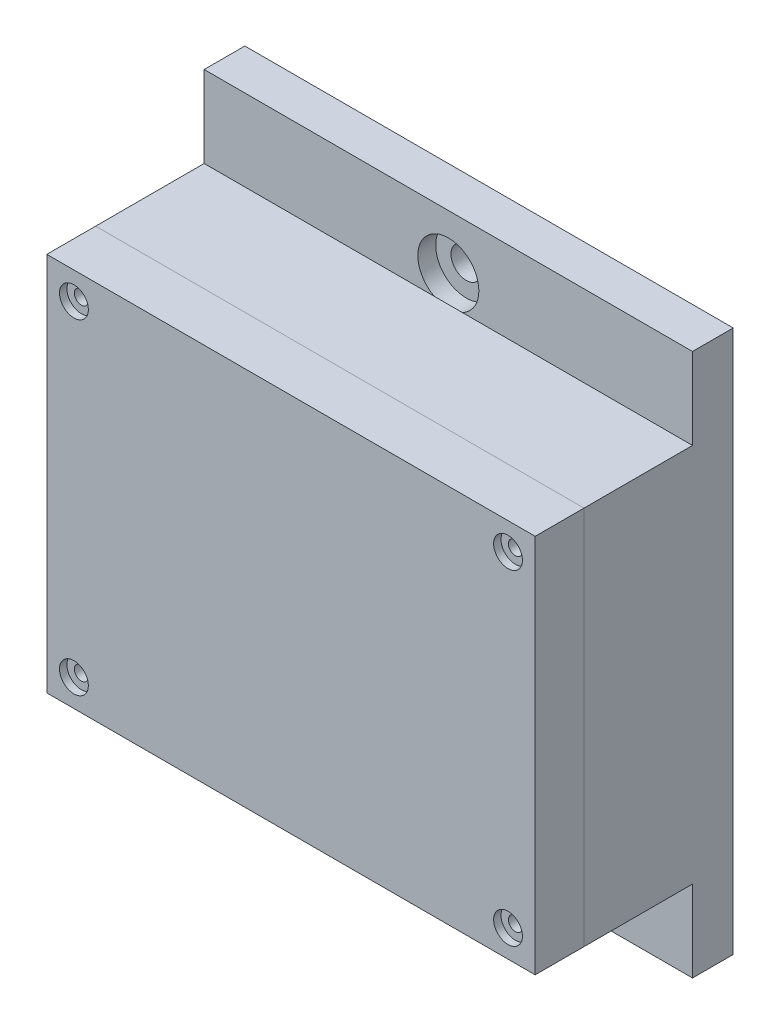
from build123d import *

# Parameters (mm, degrees)
SKETCH1_W                                            = 114.3
SKETCH1_H                                            = 127
BASE_DEPTH                                           = 9.525
CBORE_FOR_1_4_BINDING_HEAD_MACHINE_SCREW_D           = 7.14248
CBORE_FOR_1_4_BINDING_HEAD_MACHINE_SCREW_CBORE_D     = 14.2875
CBORE_FOR_1_4_BINDING_HEAD_MACHINE_SCREW_CBORE_DEPTH = 4.191
SKETCH4_W                                            = 114.3
SKETCH4_H                                            = 88.9
BOSS_EXTRUDE2_DEPTH                                  = 25.4
CUT_EXTRUDE1_REACH                                   = 129.04
SKETCH11_W                                           = 75.490330722
SKETCH11_H                                           = 17.78
CUT_EXTRUDE2_REACH                                   = 137.338
SKETCH12_W                                           = 17.78
SKETCH12_H                                           = 63.5
F_4_CLEARANCE_HOLE1_D                                = 3.2639
F_4_CLEARANCE_HOLE1_DEPTH                            = 6.35
F_4_CLEARANCE_HOLE1_TIP                              = 0.980574487
F_4_CLEARANCE_HOLE2_D                                = 3.2639
F_4_CLEARANCE_HOLE2_DEPTH                            = 6.35
F_4_CLEARANCE_HOLE2_TIP                              = 0.980574487
SKETCH23_W                                           = 6.35
SKETCH23_H                                           = 12.7
BOSS_EXTRUDE5_DEPTH                                  = 17.78
F_4_CLEARANCE_HOLE3_D                                = 3.2639
F_4_CLEARANCE_HOLE3_DEPTH                            = 6.35
F_4_CLEARANCE_HOLE3_TIP                              = 0.980574487
SKETCH27_W                                           = 29.42336
SKETCH27_H                                           = 43.18
BOSS_EXTRUDE6_DEPTH                                  = 5.08
BOSS_EXTRUDE3_DEPTH                                  = 5.08
BOSS_EXTRUDE3_2_DEPTH                                = 5.08
FILLET3_R                                            = 2.54
SKETCH14_W                                           = 114.3
SKETCH14_H                                           = 88.9
BOSS_EXTRUDE4_DEPTH                                  = 6.35
FILLET1_R                                            = 2.54
CBORE_FOR_4_BINDING_HEAD_MACHINE_SC_2_COUNT          = 2
CBORE_FOR_4_BINDING_HEAD_MACHINE_SC_2_PITCH          = 76.2
CBORE_FOR_4_BINDING_HEAD_MACHINE_SC_3_COUNT          = 2
CBORE_FOR_4_BINDING_HEAD_MACHINE_SC_3_PITCH          = 127
CBORE_FOR_4_BINDING_HEAD_MACHINE_SC_4_COUNT          = 2
CBORE_FOR_4_BINDING_HEAD_MACHINE_SC_4_PITCH          = 101.6


with BuildPart() as part:
    # Sketch1 → base (new body)
    with BuildSketch(Plane.XY):
        Rectangle(SKETCH1_W, SKETCH1_H)
    extrude(amount=BASE_DEPTH)

    # CBORE for 1/4 Binding Head Machine Screw1 (through all)
    with Locations(Plane.XY.offset(9.525)):
        with Locations((0, 50.8), (0, -50.8)):
            CounterBoreHole(CBORE_FOR_1_4_BINDING_HEAD_MACHINE_SCREW_D / 2, CBORE_FOR_1_4_BINDING_HEAD_MACHINE_SCREW_CBORE_D / 2, CBORE_FOR_1_4_BINDING_HEAD_MACHINE_SCREW_CBORE_DEPTH)

    # Sketch4 → Boss-Extrude2 (add)
    with BuildSketch(Plane.XY.offset(9.525)):
        Rectangle(SKETCH4_W, SKETCH4_H)
        Polygon((-43.460165361, 38.1), (43.460165361, 38.1), (43.460165361, 18.034), (43.460165361, 12.954), (43.460165361, -12.954), (43.460165361, -18.034), (43.460165361, -38.1), (-43.460165361, -38.1), align=None, mode=Mode.SUBTRACT)
    extrude(amount=BOSS_EXTRUDE2_DEPTH)

    # Sketch11 → Cut-Extrude1 (cut, up to next)
    with BuildSketch(Plane.XZ.offset(44.45), mode=Mode.PRIVATE) as cut_extrude1_sk1:
        with Locations((0.635, 26.035)):
            Rectangle(SKETCH11_W, SKETCH11_H)
    cut_extrude1_tool1 = extrude(cut_extrude1_sk1.sketch, amount=-CUT_EXTRUDE1_REACH, mode=Mode.PRIVATE) & part.part
    add(cut_extrude1_tool1.solids().sort_by_distance((0.635, -44.45, 26.035))[0], mode=Mode.SUBTRACT)

    # Sketch12 → Cut-Extrude2 (cut, up to next)
    with BuildSketch(Plane.ZY.offset(57.15), mode=Mode.PRIVATE) as cut_extrude2_sk1:
        with Locations((26.035, 0)):
            Rectangle(SKETCH12_W, SKETCH12_H)
    cut_extrude2_tool1 = extrude(cut_extrude2_sk1.sketch, amount=-CUT_EXTRUDE2_REACH, mode=Mode.PRIVATE) & part.part
    add(cut_extrude2_tool1.solids().sort_by_distance((-57.15, 0, 26.035))[0], mode=Mode.SUBTRACT)

    # #4 Clearance Hole1
    with Locations(Plane.XY.offset(34.925)):
        with Locations((50.8, 38.1), (50.8, -38.1), (-50.8, -38.1), (-50.8, 38.1)):
            Hole(F_4_CLEARANCE_HOLE1_D / 2, depth=F_4_CLEARANCE_HOLE1_DEPTH)
            with Locations((0, 0, -(F_4_CLEARANCE_HOLE1_DEPTH + F_4_CLEARANCE_HOLE1_TIP / 2))):  # 118° drill point
                Cone(0, F_4_CLEARANCE_HOLE1_D / 2, F_4_CLEARANCE_HOLE1_TIP, mode=Mode.SUBTRACT)

    # #4 Clearance Hole2
    with Locations(Plane.XY.offset(9.525)):
        with Locations((-35.814, -30.48), (-35.814, 30.48), (7.366, -30.48), (7.366, 30.48)):
            Hole(F_4_CLEARANCE_HOLE2_D / 2, depth=F_4_CLEARANCE_HOLE2_DEPTH)
            with Locations((0, 0, -(F_4_CLEARANCE_HOLE2_DEPTH + F_4_CLEARANCE_HOLE2_TIP / 2))):  # 118° drill point
                Cone(0, F_4_CLEARANCE_HOLE2_D / 2, F_4_CLEARANCE_HOLE2_TIP, mode=Mode.SUBTRACT)

    # Sketch23 → Boss-Extrude5 (add)
    with BuildSketch(Plane.XY.offset(9.525)):
        with Locations((17.211805361, 11.43)):
            Rectangle(SKETCH23_W, SKETCH23_H)
        with Locations((40.285165361, 11.43)):
            Rectangle(SKETCH23_W, SKETCH23_H)
    extrude(amount=BOSS_EXTRUDE5_DEPTH)

    # #4 Clearance Hole3
    with Locations(Plane(origin=(0, 5.08, 0), x_dir=(-1, 0, 0), z_dir=(0, -1, 0))):
        with Locations((-17.211805361, -20.955), (-40.285165361, -20.955)):
            Hole(F_4_CLEARANCE_HOLE3_D / 2, depth=F_4_CLEARANCE_HOLE3_DEPTH)
            with Locations((0, 0, -(F_4_CLEARANCE_HOLE3_DEPTH + F_4_CLEARANCE_HOLE3_TIP / 2))):  # 118° drill point
                Cone(0, F_4_CLEARANCE_HOLE3_D / 2, F_4_CLEARANCE_HOLE3_TIP, mode=Mode.SUBTRACT)

    # Sketch27 → Boss-Extrude6 (add)
    with BuildSketch(Plane.XY.offset(9.525)):
        with Locations((28.748485361, -16.51)):
            Rectangle(SKETCH27_W, SKETCH27_H)
    extrude(amount=BOSS_EXTRUDE6_DEPTH)

    # Fillet3
    fillet3_edges = [part.edges().sort_by_distance(p)[0] for p in [
        (43.460165361, 38.1, 22.225),
        (-43.460165361, 38.1, 22.225),
        (-43.460165361, -38.1, 22.225),
        (43.460165361, -38.1, 24.765),
        (-37.110165361, -44.45, 26.035),
        (38.380165361, -44.45, 26.035),
        (-57.15, -31.75, 26.035),
        (-57.15, 31.75, 26.035),
    ]]
    fillet(fillet3_edges, radius=FILLET3_R)


with BuildPart() as body_2:
    # Sketch13 → Boss-Extrude3 (new body)
    with BuildSketch(Plane.XY.offset(40.005)):
        Polygon((-43.460165361, 31.75), (-57.15, 31.75), (-57.15, 44.45), (57.15, 44.45), (57.15, -44.45), (38.380165361, -44.45), (38.380165361, -38.1), (43.460165361, -38.1), (43.460165361, 38.1), (-43.460165361, 38.1), align=None)
    extrude(amount=-BOSS_EXTRUDE3_DEPTH)



with BuildPart() as body_3:
    # Sketch13 → Boss-Extrude3 2 (new body)
    with BuildSketch(Plane.XY.offset(40.005)):
        Polygon((-43.460165361, -31.75), (-57.15, -31.75), (-57.15, -44.45), (-37.110165361, -44.45), (-37.110165361, -38.1), (-43.460165361, -38.1), align=None)
    extrude(amount=-BOSS_EXTRUDE3_2_DEPTH)


with BuildPart() as body_2_1:
    add(body_2.part)

    add(body_3.part)  # Boss-Extrude4 merges body 3
    # Sketch14 → Boss-Extrude4 (add)
    with BuildSketch(Plane.XY.offset(40.005)):
        Rectangle(SKETCH14_W, SKETCH14_H)
    extrude(amount=BOSS_EXTRUDE4_DEPTH)

    # Fillet1
    fillet1_edges = [body_2_1.edges().sort_by_distance(p)[0] for p in [
        (38.380165361, -41.275, 40.005),
        (40.920165361, -38.1, 40.005),
        (43.460165361, 0, 40.005),
        (0, 38.1, 40.005),
        (-43.460165361, 34.925, 40.005),
        (-43.460165361, 38.1, 37.465),
        (43.460165361, 38.1, 37.465),
        (38.380165361, -44.45, 37.465),
        (-57.15, 31.75, 37.465),
        (-57.15, 0, 40.005),
        (0.635, -44.45, 40.005),
        (-37.110165361, -44.45, 37.465),
        (-57.15, -31.75, 37.465),
        (-43.460165361, -34.925, 40.005),
        (-50.305082681, -31.75, 40.005),
        (-37.110165361, -41.275, 40.005),
        (-40.285165361, -38.1, 40.005),
        (-50.305082681, 31.75, 40.005),
    ]]
    fillet(fillet1_edges, radius=FILLET1_R)

    # Sketch29 → CBORE for #4 Binding Head Machine Screw1 (revolve, cut)
    with BuildSketch(Plane(origin=(-50.8, -38.1, 46.355), x_dir=(0, -1, 0), z_dir=(1, 0, 0))):
        Polygon((0, 0), (0, 6.060574487), (1.63195, 5.08), (1.63195, 1.7272), (3.37312, 1.7272), (3.37312, 0), align=None)
    cbore_for_4_binding_head_machine_screw1 = revolve(axis=Axis((-50.8, -38.1, 52.705), (0, 0, -1)), mode=Mode.SUBTRACT)

    # CBORE for _4 Binding Head Machine Sc 2: CBORE for #4 Binding Head Machine Screw1 ×2
    with Locations(*[(0, i * CBORE_FOR_4_BINDING_HEAD_MACHINE_SC_2_PITCH, 0) for i in range(1, CBORE_FOR_4_BINDING_HEAD_MACHINE_SC_2_COUNT)]):
        add(cbore_for_4_binding_head_machine_screw1, mode=Mode.SUBTRACT)

    # CBORE for _4 Binding Head Machine Sc 3: CBORE for #4 Binding Head Machine Screw1 ×2
    with Locations(*[Vector(0.8, 0.5999999999999999, 0) * (i * CBORE_FOR_4_BINDING_HEAD_MACHINE_SC_3_PITCH) for i in range(1, CBORE_FOR_4_BINDING_HEAD_MACHINE_SC_3_COUNT)]):
        add(cbore_for_4_binding_head_machine_screw1, mode=Mode.SUBTRACT)

    # CBORE for _4 Binding Head Machine Sc 4: CBORE for #4 Binding Head Machine Screw1 ×2
    with Locations(*[(i * CBORE_FOR_4_BINDING_HEAD_MACHINE_SC_4_PITCH, 0, 0) for i in range(1, CBORE_FOR_4_BINDING_HEAD_MACHINE_SC_4_COUNT)]):
        add(cbore_for_4_binding_head_machine_screw1, mode=Mode.SUBTRACT)


solid = Compound([part.part, body_2_1.part])
